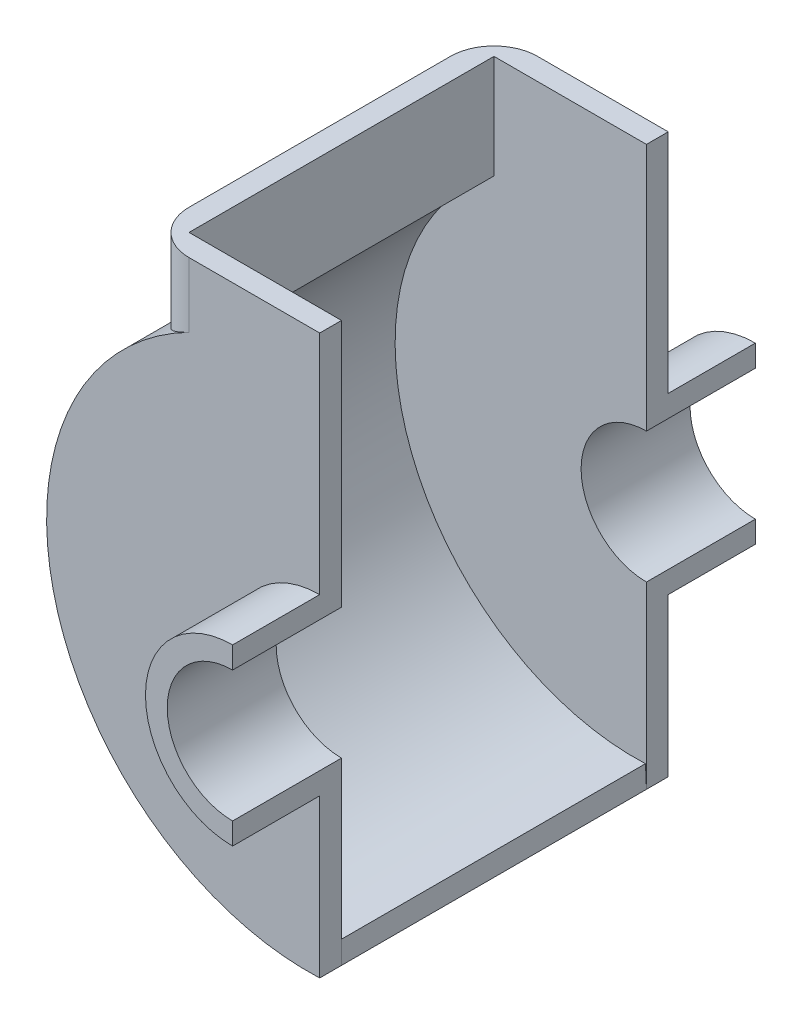
from build123d import *

# Parameters (mm, degrees)
DODANIE_WYCI_GNI_CIE1_DEPTH       = 25
DODANIE_WYCI_GNI_CIE2_DEPTH       = 5
WYCI_GNI_CIE_CIENKA_CIANKA1_DEPTH = 70
ZAOKR_GLENIE1_R                   = 10


with BuildPart() as part:
    # Szkic1 → Dodanie-wyciągnięcie1 (new body)
    with BuildSketch(Plane.XY):
        with BuildLine():
            Line((0, 15), (0, 20))
            ThreePointArc((0, 20), (-20, 0), (0, -20))
            Line((0, -20), (0, -15))
            ThreePointArc((0, -15), (-15, 0), (0, 15))
        make_face()
    extrude(amount=DODANIE_WYCI_GNI_CIE1_DEPTH)

    # Szkic2 → Dodanie-wyciągnięcie2 (add)
    with BuildSketch(Plane.XY):
        with BuildLine():
            Line((0, 20), (0, 72))
            Line((0, 72), (-40, 72))
            Line((-40, 72), (-40, 50.70936694))
            ThreePointArc((-40, 50.70936694), (-58.888387013, -17.302808514), (0, -56.220478651))
            Line((0, -56.220478651), (0, -20))
            Line((0, -20), (0, -15))
            ThreePointArc((0, -15), (-15, 0), (0, 15))
            Line((0, 15), (0, 20))
        make_face()
    extrude(amount=DODANIE_WYCI_GNI_CIE2_DEPTH)


with BuildPart() as body_2:
    # Lustro4: mirrored copy
    add(part.part.mirror(Plane(origin=(0, 0, -35), x_dir=(1, 0, 0), z_dir=(0, 0, -1))))


with BuildPart() as part_1:
    add(part.part)

    add(body_2.part)  # Wyciągnięcie-cienka ścianka1 merges body 2
    # Szkic14 → Wyciągnięcie-cienka ścianka1 (add)
    with BuildSketch(Plane(origin=(0, 0, 0), x_dir=(-1, 0, 0), z_dir=(0, 0, -1))):
        with BuildLine():
            Line((40, 72), (40, 50.70936694))
            ThreePointArc((40, 50.70936694), (58.888387013, -17.302808514), (0, -56.220478651))
            Line((0, -56.220478651), (0.224300204, -51.225512243))
            ThreePointArc((0.224300204, -51.225512243), (54.609267077, -14.434561812), (35, 48.229425454))
            Line((35, 48.229425454), (35, 72))
            Line((35, 72), (40, 72))
        make_face()
    extrude(amount=WYCI_GNI_CIE_CIENKA_CIANKA1_DEPTH)

    # Zaokrąglenie1
    zaokr_glenie1_edges = [part_1.edges().sort_by_distance(p)[0] for p in [
        (-40, 61.35468347, 5),
        (-40, 61.35468347, -75),
    ]]
    fillet(zaokr_glenie1_edges, radius=ZAOKR_GLENIE1_R)


solid = part_1.part
